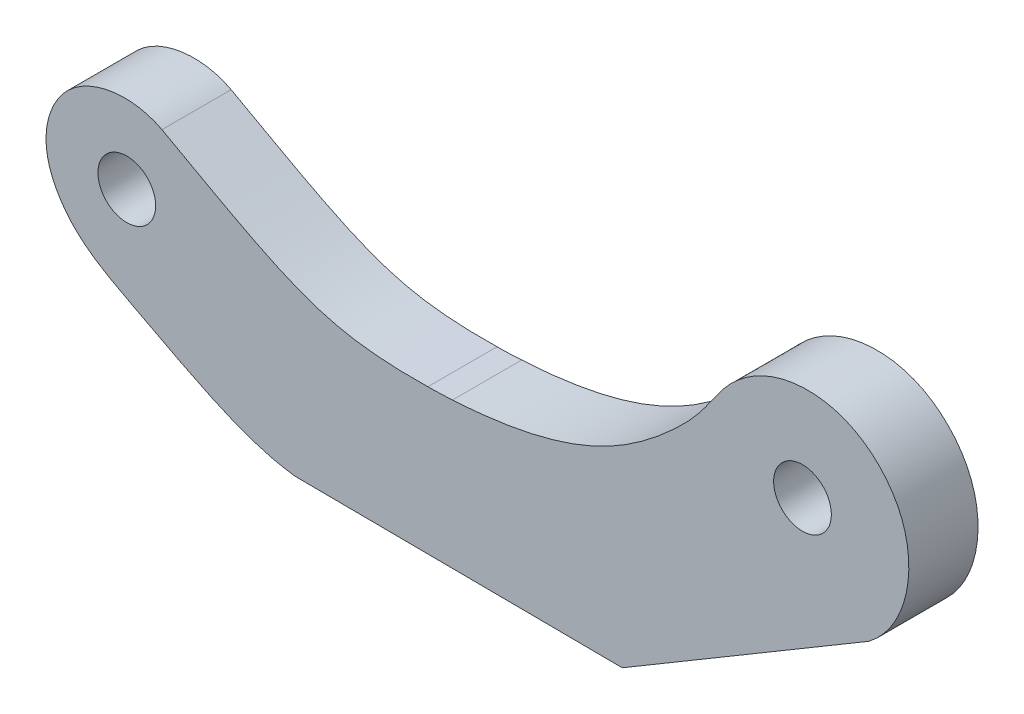
from build123d import *

# Parameters (mm, degrees)
SCHIZZO1_R                   = 1.7
ESTRUSIONE_ESTRUSIONE1_DEPTH = 4.077


with BuildPart() as part:
    # Schizzo1 → Estrusione-Estrusione1 (new body)
    with BuildSketch(Plane.XY.offset(5.05)):
        with BuildLine():
            Line((-65.088157236, 10.27368012), (-45.806517375, 10.138527109))
            Line((-45.806517375, 10.138527109), (-31.279343931, 18.753125585))
            add(Edge.make_bspline(
                [(-31.279343931, 18.753125585), (-29.098043345, 20.403651058), (-27.905057256, 25.441624833), (-32.300384053, 29.85841163), (-36.690541673, 29.918863446), (-39.614892883, 27.942376602), (-41.03245157, 25.552100431), (-43.284640457, 23.241638673), (-47.763557065, 19.862154048), (-52.57074608, 18.979169365), (-55.803154975, 18.8049533)],
                knots=[0, 0, 0, 0, 0.102244465, 0.160154236, 0.214292787, 0.256272844, 0.289149591, 0.319658417, 0.379342086, 0.500706378, 0.500706378, 0.500706378, 0.500706378], degree=3))
            add(Edge.make_bspline(
                [(-57.25626525, 18.753125585), (-56.52869344, 18.753125585), (-55.803154975, 18.8049533)],
                knots=[4.71238898, 4.71238898, 4.71238898, 4.787168695, 4.787168695, 4.787168695], degree=2, weights=[1, 0.999301081, 1]))
            add(Edge.make_bspline(
                [(-57.25626525, 18.753125585), (-59.155150134, 18.717879159), (-63.127762505, 18.895973961), (-68.251383716, 21.432820435), (-71.466164586, 23.233839924), (-72.923411034, 24.034523908)],
                knots=[0.518902231, 0.518902231, 0.518902231, 0.518902231, 0.590344576, 0.669858142, 0.733003007, 0.733003007, 0.733003007, 0.733003007], degree=3))
            add(Edge.make_bspline(
                [(-72.923411034, 24.034523908), (-74.666838591, 24.972814401), (-78.608984565, 24.433280608), (-80.322463607, 19.660976663), (-78.265100941, 16.127751093), (-74.780476619, 14.267051221), (-70.589814259, 12.049912577), (-67.299822618, 10.554068254), (-65.088157236, 10.27368012)],
                knots=[0, 0, 0, 0, 0.216025249, 0.338628166, 0.486312744, 0.611906589, 0.763100731, 1, 1, 1, 1], degree=3))
        make_face()
        with Locations((-74.993560801, 19.956508848)):
            Circle(SCHIZZO1_R, mode=Mode.SUBTRACT)
        with Locations((-35.18906777, 24.113568479)):
            Circle(SCHIZZO1_R, mode=Mode.SUBTRACT)
    extrude(amount=ESTRUSIONE_ESTRUSIONE1_DEPTH)


solid = part.part
